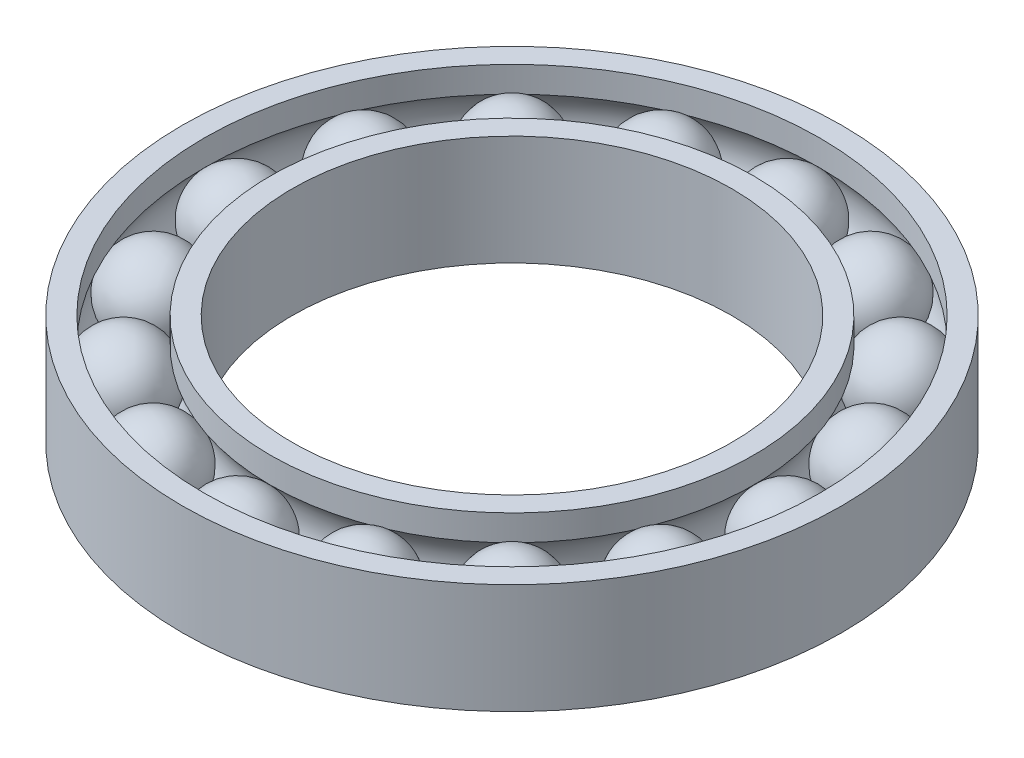
from build123d import *

# Parameters (mm, degrees)
CIRPATTERN2_COUNT = 16


with BuildPart() as part:
    # Sketch2 → Revolve1 (revolve)
    with BuildSketch(Plane(origin=(0, 0, 0), x_dir=(0, 0, -1), z_dir=(1, 0, 0))):
        with BuildLine():
            Line((52.5, 0), (72.5, 0))
            ThreePointArc((72.5, 0), (62.5, 10), (52.5, 0))
        make_face()
    revolve(axis=Axis((0, 0, -52.5), (0, 0, -1)))


with BuildPart() as body_2:
    # Sketch1 → Revolve2 (revolve)
    with BuildSketch(Plane(origin=(0, 0, 0), x_dir=(0, 0, -1), z_dir=(1, 0, 0))):
        with BuildLine():
            Line((70, 12.5), (70, 6.614378278))
            ThreePointArc((70, 6.614378278), (72.5, 0), (70, -6.614378278))
            Line((70, -6.614378278), (70, -12.5))
            Line((70, -12.5), (75, -12.5))
            Line((75, -12.5), (75, 12.5))
            Line((75, 12.5), (70, 12.5))
        make_face()
        with BuildLine():
            Line((50, 12.5), (50, -12.5))
            Line((50, -12.5), (55, -12.5))
            Line((55, -12.5), (55, -6.614378278))
            ThreePointArc((55, -6.614378278), (52.5, 0), (55, 6.614378278))
            Line((55, 6.614378278), (55, 12.5))
            Line((55, 12.5), (50, 12.5))
        make_face()
    revolve(axis=Axis((0, -12.5, 0), (0, 1, 0)))


with BuildPart() as cirpattern2_1:
    # CirPattern2: pattern copy
    add(part.part.rotate(Axis((0, -8.25, 0), (0, 1, 0)), 1 * 360 / CIRPATTERN2_COUNT))


with BuildPart() as cirpattern2_2:
    # CirPattern2: pattern copy
    add(part.part.rotate(Axis((0, -8.25, 0), (0, 1, 0)), 2 * 360 / CIRPATTERN2_COUNT))


with BuildPart() as cirpattern2_3:
    # CirPattern2: pattern copy
    add(part.part.rotate(Axis((0, -8.25, 0), (0, 1, 0)), 3 * 360 / CIRPATTERN2_COUNT))


with BuildPart() as cirpattern2_4:
    # CirPattern2: pattern copy
    add(part.part.rotate(Axis((0, -8.25, 0), (0, 1, 0)), 4 * 360 / CIRPATTERN2_COUNT))


with BuildPart() as cirpattern2_5:
    # CirPattern2: pattern copy
    add(part.part.rotate(Axis((0, -8.25, 0), (0, 1, 0)), 5 * 360 / CIRPATTERN2_COUNT))


with BuildPart() as cirpattern2_6:
    # CirPattern2: pattern copy
    add(part.part.rotate(Axis((0, -8.25, 0), (0, 1, 0)), 6 * 360 / CIRPATTERN2_COUNT))


with BuildPart() as cirpattern2_7:
    # CirPattern2: pattern copy
    add(part.part.rotate(Axis((0, -8.25, 0), (0, 1, 0)), 7 * 360 / CIRPATTERN2_COUNT))


with BuildPart() as cirpattern2_8:
    # CirPattern2: pattern copy
    add(part.part.rotate(Axis((0, -8.25, 0), (0, 1, 0)), 8 * 360 / CIRPATTERN2_COUNT))


with BuildPart() as cirpattern2_9:
    # CirPattern2: pattern copy
    add(part.part.rotate(Axis((0, -8.25, 0), (0, 1, 0)), 9 * 360 / CIRPATTERN2_COUNT))


with BuildPart() as cirpattern2_10:
    # CirPattern2: pattern copy
    add(part.part.rotate(Axis((0, -8.25, 0), (0, 1, 0)), 10 * 360 / CIRPATTERN2_COUNT))


with BuildPart() as cirpattern2_11:
    # CirPattern2: pattern copy
    add(part.part.rotate(Axis((0, -8.25, 0), (0, 1, 0)), 11 * 360 / CIRPATTERN2_COUNT))


with BuildPart() as cirpattern2_12:
    # CirPattern2: pattern copy
    add(part.part.rotate(Axis((0, -8.25, 0), (0, 1, 0)), 12 * 360 / CIRPATTERN2_COUNT))


with BuildPart() as cirpattern2_13:
    # CirPattern2: pattern copy
    add(part.part.rotate(Axis((0, -8.25, 0), (0, 1, 0)), 13 * 360 / CIRPATTERN2_COUNT))


with BuildPart() as cirpattern2_14:
    # CirPattern2: pattern copy
    add(part.part.rotate(Axis((0, -8.25, 0), (0, 1, 0)), 14 * 360 / CIRPATTERN2_COUNT))


with BuildPart() as cirpattern2_15:
    # CirPattern2: pattern copy
    add(part.part.rotate(Axis((0, -8.25, 0), (0, 1, 0)), 15 * 360 / CIRPATTERN2_COUNT))


solid = Compound([part.part, body_2.part, cirpattern2_1.part, cirpattern2_2.part, cirpattern2_3.part, cirpattern2_4.part, cirpattern2_5.part, cirpattern2_6.part, cirpattern2_7.part, cirpattern2_8.part, cirpattern2_9.part, cirpattern2_10.part, cirpattern2_11.part, cirpattern2_12.part, cirpattern2_13.part, cirpattern2_14.part, cirpattern2_15.part])
